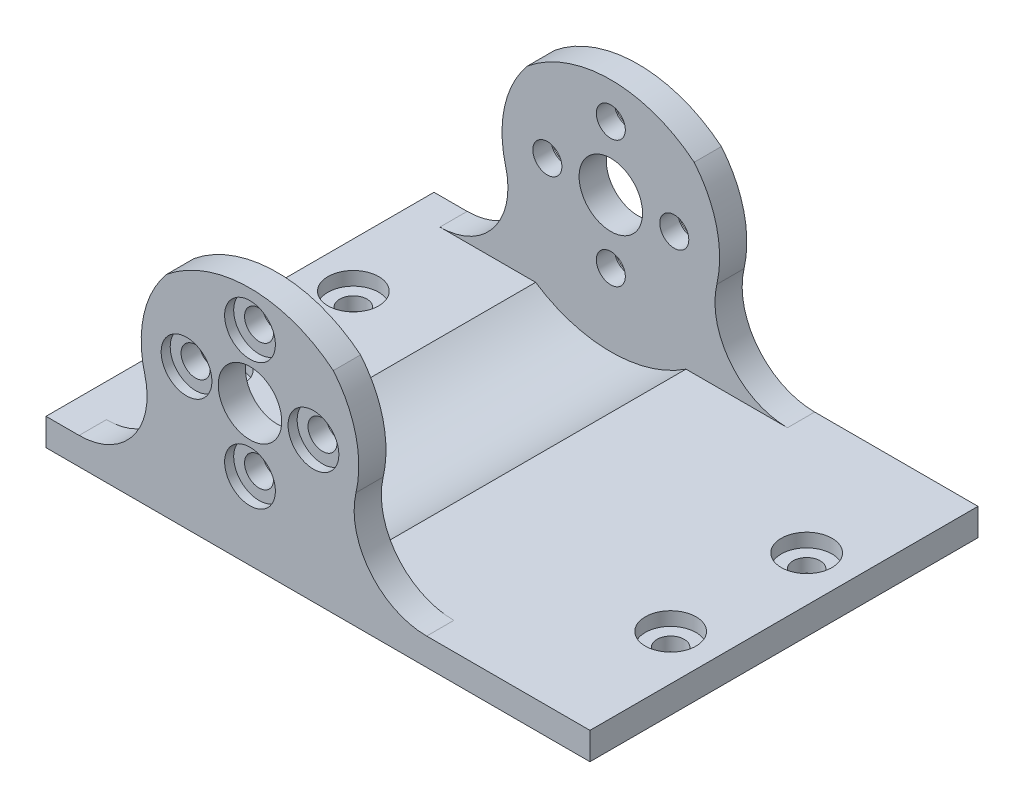
from build123d import *

# Parameters (mm, degrees)
SKETCH_1_R                      = 13
EXTRUDE_1_DEPTH                 = 42.8
SKETCH_2_R                      = 3.5
CUT_EXTRUDE_1_DEPTH             = 47.581541409
SKETCH_4_R                      = 1.6
CUT_EXTRUDE_2_DEPTH             = 47.581541409
EXTRUDE_2_DEPTH                 = 42.8
CUT_EXTRUDE_3_DEPTH             = 42.8
CUT_EXTRUDE_4_DEPTH             = 18.4
CUT_EXTRUDE_4_DEPTH_BACK        = 18.4
CUT_EXTRUDE_5_DEPTH             = 63.153760948
CUT_EXTRUDE_5_DEPTH_BACK        = 63.153760948
SKETCH_9_R                      = 1.5
CUT_EXTRUDE_6_DEPTH             = 63.153760948
CUT_EXTRUDE_6_DEPTH_BACK        = 1.5
SKETCH_10_R                     = 2.8
SKETCH_11_R                     = 2.8
CUT_EXTRUDE_7_DEPTH             = 1
CUT_EXTRUDE_8_REACH             = 47.874
CUT_EXTRUDE_8_DIRECTION_2_REACH = 47.874
CUT_EXTRUDE_9_DEPTH             = 59.977453319
CUT_EXTRUDE_10_DEPTH            = 59.977453319


with BuildPart() as part:
    # 草图1 → 凸台-拉伸1 (new body)
    with BuildSketch(Plane.XY):
        Circle(SKETCH_1_R)
    extrude(amount=EXTRUDE_1_DEPTH)

    # 草图2 → 切除-拉伸1 (cut, through all)
    with BuildSketch(Plane.XY.offset(42.8)):
        Circle(SKETCH_2_R)
    extrude(amount=-CUT_EXTRUDE_1_DEPTH, mode=Mode.SUBTRACT)

    # 草图4 → 切除-拉伸2 (cut, through all)
    with BuildSketch(Plane(origin=(0, 0, 0), x_dir=(-1, 0, 0), z_dir=(0, 0, -1))):
        with Locations((0, 7)):
            Circle(SKETCH_4_R)
        with Locations((7, 0)):
            Circle(SKETCH_4_R)
        with Locations((0, -7)):
            Circle(SKETCH_4_R)
        with Locations((-7, 0)):
            Circle(SKETCH_4_R)
    extrude(amount=-CUT_EXTRUDE_2_DEPTH, mode=Mode.SUBTRACT)

    # 草图5 → 凸台-拉伸2 (add)
    with BuildSketch(Plane(origin=(0, 0, 0), x_dir=(-1, 0, 0), z_dir=(0, 0, -1))):
        with BuildLine():
            ThreePointArc((-12.755, -2.511966361), (-17.099037385, -9.686319722), (-25, -12.5))
            Line((-25, -12.5), (-37.5, -12.5))
            Line((-37.5, -12.5), (-37.5, -15.5))
            Line((-37.5, -15.5), (22.5, -15.5))
            Line((22.5, -15.5), (22.5, -12.5))
            ThreePointArc((22.5, -12.5), (16.150397643, -8.956340583), (12.751851852, -2.527899197))
            ThreePointArc((12.751851852, -2.527899197), (-0.008120438, -12.999997464), (-12.755, -2.511966361))
        make_face()
    extrude(amount=-EXTRUDE_2_DEPTH)

    # 草图7 → 切除-拉伸3 (cut)
    with BuildSketch(Plane(origin=(0, 0, 0), x_dir=(-1, 0, 0), z_dir=(0, 0, -1))):
        with BuildLine():
            ThreePointArc((12.5, 0), (0, 12.5), (-12.5, 0))
            ThreePointArc((-12.5, 0), (-12.563913397, -1.262438117), (-12.755, -2.511966361))
            ThreePointArc((-12.755, -2.511966361), (0.008120438, 12.999997464), (12.751851852, -2.527899197))
            ThreePointArc((12.751851852, -2.527899197), (12.563118434, -1.270207041), (12.5, 0))
        make_face()
    extrude(amount=-CUT_EXTRUDE_3_DEPTH, mode=Mode.SUBTRACT)

    # 草图8 → 切除-拉伸4 (cut, two sides: drawn at the far end of the back side and taken through both)
    with BuildSketch(Plane.XY.offset(21.4).offset(-CUT_EXTRUDE_4_DEPTH_BACK)):
        with BuildLine():
            ThreePointArc((-12.5, 0), (-8.838834765, -8.838834765), (0, -12.5))
            ThreePointArc((0, -12.5), (8.838834765, -8.838834765), (12.5, 0))
            ThreePointArc((12.5, 0), (0, 12.5), (-12.5, 0))
        make_face()
        with BuildLine():
            Line((-22.5, -12.5), (0, -12.5))
            ThreePointArc((0, -12.5), (-8.838834765, -8.838834765), (-12.5, 0))
            ThreePointArc((-12.5, 0), (-15.307618379, -8.003905297), (-22.5, -12.5))
        make_face()
        with BuildLine():
            ThreePointArc((12.5, 0), (8.838834765, -8.838834765), (0, -12.5))
            Line((0, -12.5), (25, -12.5))
            ThreePointArc((25, -12.5), (16.161165235, -8.838834765), (12.5, 0))
        make_face()
    extrude(amount=CUT_EXTRUDE_4_DEPTH + CUT_EXTRUDE_4_DEPTH_BACK, mode=Mode.SUBTRACT)

    # 草图9 → 切除-拉伸5 (cut, two sides: drawn at the far end of the back side and taken through both)
    with BuildSketch(Plane(origin=(0, -12.5, 0), x_dir=(1, 0, 0), z_dir=(0, 1, 0)).offset(-CUT_EXTRUDE_5_DEPTH_BACK)):
        with Locations(Location((32.5, -13.9, 0), (0, 0, 180))):
            Circle(SKETCH_9_R)
        with Locations(Location((32.5, -28.9, 0), (0, 0, 180))):
            Circle(SKETCH_9_R)
        with Locations(Location((-17.5, -13.9, 0), (0, 0, 180))):
            Circle(SKETCH_9_R)
        with Locations(Location((-17.5, -28.9, 0), (0, 0, 180))):
            Circle(SKETCH_9_R)
    extrude(amount=CUT_EXTRUDE_5_DEPTH + CUT_EXTRUDE_5_DEPTH_BACK, mode=Mode.SUBTRACT)

    # 草图10 → 切除-拉伸6 (cut, two sides: drawn at the far end of the back side and taken through both)
    with BuildSketch(Plane(origin=(0, -12.5, 0), x_dir=(1, 0, 0), z_dir=(0, 1, 0)).offset(-CUT_EXTRUDE_6_DEPTH_BACK)):
        with Locations(Location((-17.5, -13.9, 0), (0, 0, 180))):
            Circle(SKETCH_10_R)
        with Locations(Location((-17.5, -28.9, 0), (0, 0, 180))):
            Circle(SKETCH_10_R)
        with Locations(Location((32.5, -13.9, 0), (0, 0, 180))):
            Circle(SKETCH_10_R)
        with Locations(Location((32.5, -28.9, 0), (0, 0, 180))):
            Circle(SKETCH_10_R)
    extrude(amount=CUT_EXTRUDE_6_DEPTH + CUT_EXTRUDE_6_DEPTH_BACK, mode=Mode.SUBTRACT)

    # 草图11 → 切除-拉伸7 (cut)
    with BuildSketch(Plane(origin=(0, 0, 0), x_dir=(-1, 0, 0), z_dir=(0, 0, -1))):
        with Locations((0, 7)):
            Circle(SKETCH_11_R)
        with Locations((7, 0)):
            Circle(SKETCH_11_R)
        with Locations((0, -7)):
            Circle(SKETCH_11_R)
        with Locations((-7, 0)):
            Circle(SKETCH_11_R)
    cut_extrude_7 = extrude(amount=-CUT_EXTRUDE_7_DEPTH, mode=Mode.SUBTRACT)

    # 镜向1: 切除-拉伸7 across plane
    add(cut_extrude_7.mirror(Plane.XY.offset(21.4)), mode=Mode.SUBTRACT)

    # 切除-拉伸8: up to this face of the body (flat: up to its plane)
    cut_extrude_8_end = Plane(part.part.faces().sort_by_distance((0, 11.963227236, 3))[0])
    # 草图12 → 切除-拉伸8 (cut, up to the picked face)
    with BuildSketch(Plane.XY.offset(21.4), mode=Mode.PRIVATE) as cut_extrude_8_sk1:
        with BuildLine():
            Line((8.291561976, -12.5), (-8.291561976, -12.5))
            ThreePointArc((-8.291561976, -12.5), (0, -15), (8.291561976, -12.5))
        make_face()
    cut_extrude_8_tool1 = split(extrude(cut_extrude_8_sk1.sketch, amount=-CUT_EXTRUDE_8_REACH, mode=Mode.PRIVATE), bisect_by=cut_extrude_8_end, keep=Keep.BOTH, mode=Mode.PRIVATE)
    add(cut_extrude_8_tool1.solids().sort_by(Axis((0, -13.507506, 21.4), (0, 0, -1)))[0], mode=Mode.SUBTRACT)

    # 切除-拉伸8 direction 2: up to this face of the body (flat: up to its plane)
    cut_extrude_8_direction_2_end = Plane(part.part.faces().sort_by_distance((0, 11.963227236, 39.8))[0])
    # 草图12 → 切除-拉伸8 direction 2 (cut, up to the picked face)
    with BuildSketch(Plane.XY.offset(21.4), mode=Mode.PRIVATE) as cut_extrude_8_direction_2_sk1:
        with BuildLine():
            Line((8.291561976, -12.5), (-8.291561976, -12.5))
            ThreePointArc((-8.291561976, -12.5), (0, -15), (8.291561976, -12.5))
        make_face()
    cut_extrude_8_direction_2_tool1 = split(extrude(cut_extrude_8_direction_2_sk1.sketch, amount=CUT_EXTRUDE_8_DIRECTION_2_REACH, mode=Mode.PRIVATE), bisect_by=cut_extrude_8_direction_2_end, keep=Keep.BOTH, mode=Mode.PRIVATE)
    add(cut_extrude_8_direction_2_tool1.solids().sort_by(Axis((0, -13.507506, 21.4), (0, 0, 1)))[0], mode=Mode.SUBTRACT)

    # 草图13 → 切除-拉伸9 (cut, through all)
    with BuildSketch(Plane(origin=(0, 0, 0), x_dir=(-1, 0, 0), z_dir=(0, 0, -1))):
        with BuildLine():
            ThreePointArc((10.98532184, 5.964285714), (0, 11), (-10.98532184, 5.964285714))
            ThreePointArc((-10.98532184, 5.964285714), (0, 12.5), (10.98532184, 5.964285714))
        make_face()
    extrude(amount=-CUT_EXTRUDE_9_DEPTH, mode=Mode.SUBTRACT)

    # 草图14 → 切除-拉伸10 (cut, through all)
    with BuildSketch(Plane.XY.offset(42.8)):
        with BuildLine():
            ThreePointArc((-21.180750885, -12.128017377), (-20.029150419, -12.406420537), (-18.848076825, -12.5))
            ThreePointArc((-18.848076825, -12.5), (-13.544775966, -10.303300859), (-11.348076825, -5))
            ThreePointArc((-11.348076825, -5), (-11.411025921, -4.030322808), (-11.59881652, -3.076923029))
            ThreePointArc((-11.59881652, -3.076923029), (-11.98420936, -1.977199407), (-12.535301413, -0.950448592))
            ThreePointArc((-12.535301413, -0.950448592), (-15.17777558, -7.838846674), (-21.180750885, -12.128017377))
        make_face()
        with BuildLine():
            ThreePointArc((-12.535301413, -0.950448592), (-24.780598437, -0.411406825), (-21.180750885, -12.128017377))
            ThreePointArc((-21.180750885, -12.128017377), (-15.17777558, -7.838846674), (-12.535301413, -0.950448592))
        make_face()
        with BuildLine():
            ThreePointArc((-12.5, 0), (-12.508828395, -0.475551973), (-12.535301413, -0.950448592))
            ThreePointArc((-12.535301413, -0.950448592), (-11.98420936, -1.977199407), (-11.59881652, -3.076923029))
            ThreePointArc((-11.59881652, -3.076923029), (-11.71218701, 2.61240798), (-9.19183311, 7.714285714))
            ThreePointArc((-9.19183311, 7.714285714), (-10.126451524, 6.87810096), (-10.98532184, 5.964285714))
            ThreePointArc((-10.98532184, 5.964285714), (-12.115414211, 3.076806543), (-12.5, 0))
        make_face()
        with BuildLine():
            ThreePointArc((-21.180750885, -12.128017377), (-21.835397512, -12.331663089), (-22.5, -12.5))
            Line((-22.5, -12.5), (-18.848076825, -12.5))
            ThreePointArc((-18.848076825, -12.5), (-20.029150419, -12.406420537), (-21.180750885, -12.128017377))
        make_face()
        with BuildLine():
            ThreePointArc((21.931346237, -12.117481755), (20.724136458, -12.403791939), (19.48717527, -12.5))
            Line((19.48717527, -12.5), (25, -12.5))
            ThreePointArc((25, -12.5), (23.453798515, -12.404001813), (21.931346237, -12.117481755))
        make_face()
        with BuildLine():
            ThreePointArc((11.692305187, -2.699999893), (13.226184899, -9.479959796), (19.48717527, -12.5))
            ThreePointArc((19.48717527, -12.5), (20.724136458, -12.403791939), (21.931346237, -12.117481755))
            ThreePointArc((21.931346237, -12.117481755), (15.316506899, -7.904426694), (12.513458103, -0.579889175))
            ThreePointArc((12.513458103, -0.579889175), (12.027181322, -1.610624584), (11.692305187, -2.699999893))
        make_face()
        with BuildLine():
            ThreePointArc((12.513458103, -0.579889175), (15.316506899, -7.904426694), (21.931346237, -12.117481755))
            ThreePointArc((21.931346237, -12.117481755), (25.950663791, -9.214161233), (27.48717527, -4.5))
            ThreePointArc((27.48717527, -4.5), (21.513287639, 3.239177519), (12.513458103, -0.579889175))
        make_face()
        with BuildLine():
            ThreePointArc((12, 0), (11.922828151, -1.358737973), (11.692305187, -2.699999893))
            ThreePointArc((11.692305187, -2.699999893), (12.027181322, -1.610624584), (12.513458103, -0.579889175))
            ThreePointArc((12.513458103, -0.579889175), (12.503364979, -0.290022661), (12.5, 0))
            ThreePointArc((12.5, 0), (12.115414211, 3.076806543), (10.98532184, 5.964285714))
            ThreePointArc((10.98532184, 5.964285714), (10.126451524, 6.87810096), (9.19183311, 7.714285714))
            ThreePointArc((9.19183311, 7.714285714), (11.276125162, 4.104753506), (12, 0))
        make_face()
    extrude(amount=-CUT_EXTRUDE_10_DEPTH, mode=Mode.SUBTRACT)


solid = part.part
